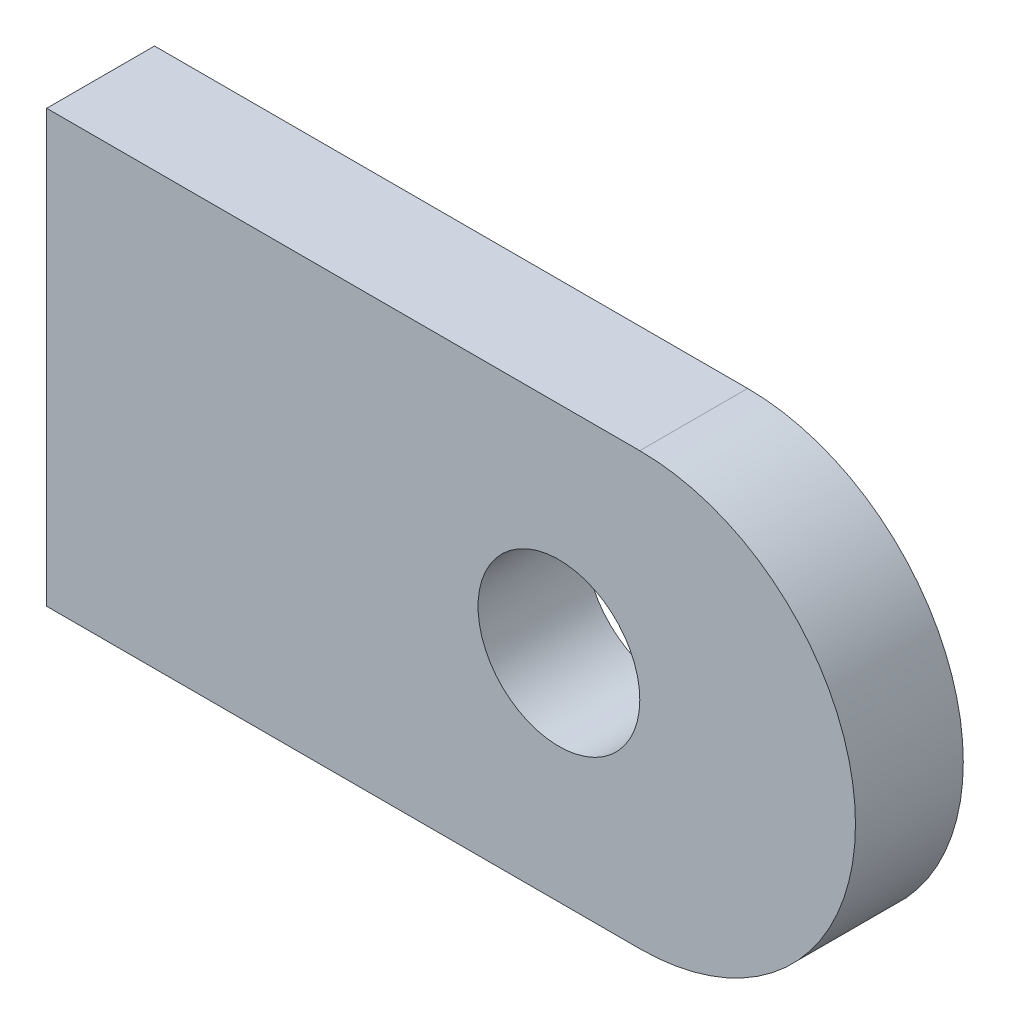
from build123d import *

# Parameters (mm, degrees)
SKETCH1_R           = 75
BOSS_EXTRUDE1_DEPTH = 100


with BuildPart() as part:
    # Sketch1 → Boss-Extrude1 (new body)
    with BuildSketch(Plane.XY):
        with BuildLine():
            Line((275, -200), (-275, -200))
            Line((-275, -200), (-275, 200))
            Line((-275, 200), (275, 200))
            ThreePointArc((275, 200), (475, 0), (275, -200))
        make_face()
        with Locations((200, 0)):
            Circle(SKETCH1_R, mode=Mode.SUBTRACT)
    extrude(amount=BOSS_EXTRUDE1_DEPTH)


solid = part.part
